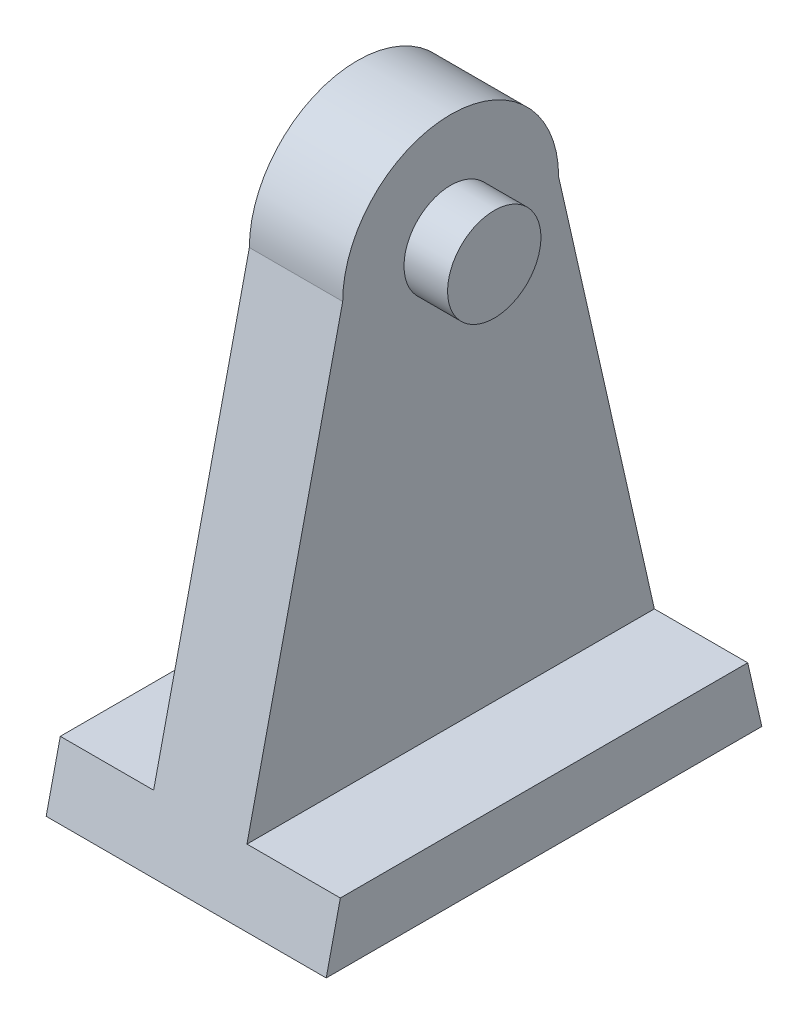
from build123d import *

# Parameters (mm, degrees)
BOSS_EXTRUDE1_DEPTH = 7.5
BOSS_EXTRUDE2_DEPTH = 22.5
SKETCH1_4_R         = 7.5
BOSS_EXTRUDE3_DEPTH = 14.5


with BuildPart() as part:
    # Sketch1 → Boss-Extrude1 (new, symmetric)
    with BuildSketch(Plane(origin=(0, 0, 0), x_dir=(0, 0, -1), z_dir=(1, 0, 0))):
        with BuildLine():
            Line((-17.35, 77.82), (-35, 0))
            Line((-35, 0), (35, 0))
            Line((35, 0), (17.35, 77.82))
            ThreePointArc((17.35, 77.82), (0, 95.17), (-17.35, 77.82))
        make_face()
    extrude(amount=BOSS_EXTRUDE1_DEPTH, both=True)

    # Sketch1<3> → Boss-Extrude2 (add, symmetric)
    with BuildSketch(Plane(origin=(0, 0, 0), x_dir=(0, 0, -1), z_dir=(1, 0, 0))):
        Polygon((-32.731945515, 10), (-35, 0), (35, 0), (32.731945515, 10), align=None)
    extrude(amount=BOSS_EXTRUDE2_DEPTH, both=True)

    # Sketch1<4> → Boss-Extrude3 (add)
    with BuildSketch(Plane(origin=(0, 0, 0), x_dir=(0, 0, -1), z_dir=(1, 0, 0))):
        with Locations((0, 77.82)):
            Circle(SKETCH1_4_R)
    extrude(amount=BOSS_EXTRUDE3_DEPTH)


solid = part.part
